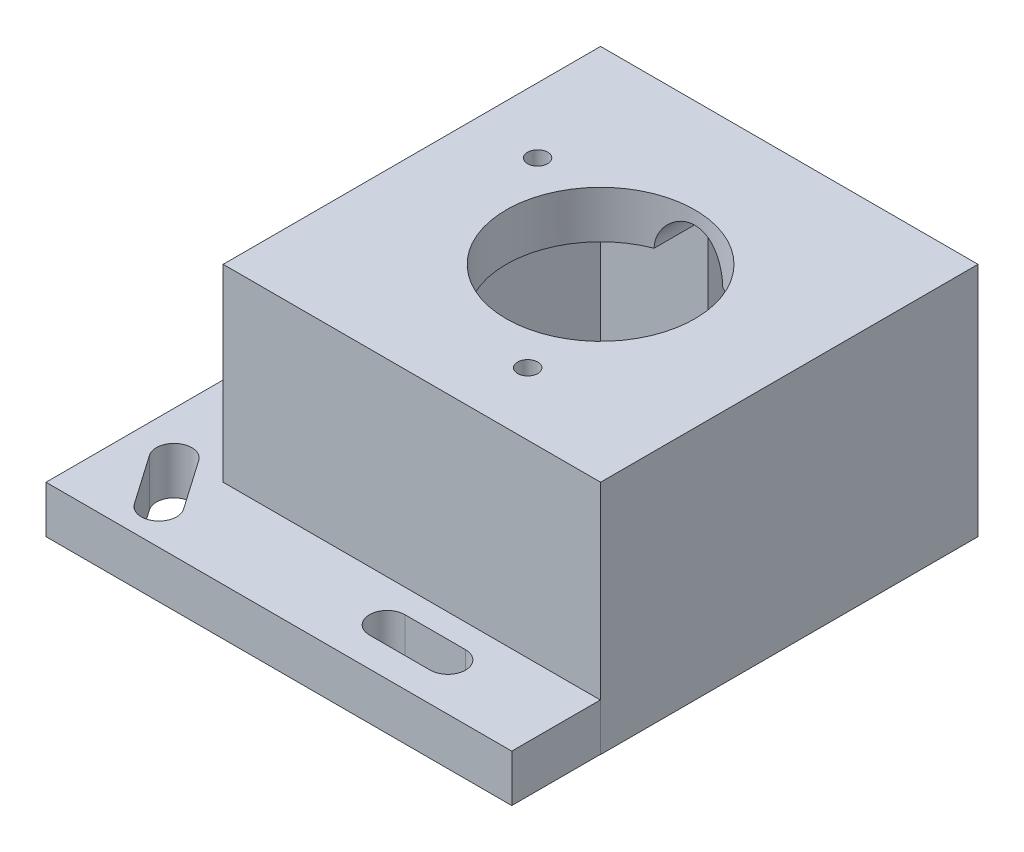
from build123d import *

# Parameters (mm, degrees)
SKETCH1_W             = 50.8
SKETCH1_H             = 50.8
SKETCH1_R             = 12.7
BOSS_EXTRUDE2_DEPTH   = 31.75
BOSS_EXTRUDE5_DEPTH   = 6.35
CUT_EXTRUDE2_DEPTH    = 6.35
CUT_EXTRUDE3_DEPTH    = 6.35
SKETCH12_W            = 38.1
SKETCH12_H            = 38.1
CUT_EXTRUDE6_DEPTH    = 25.4
F_6_32_TAPPED_HOLE3_D = 2.7051
CUT_EXTRUDE7_DEPTH    = 25.4


with BuildPart() as part:
    # Sketch1 → Boss-Extrude2 (new body)
    with BuildSketch(Plane(origin=(0, 0, 0), x_dir=(1, 0, 0), z_dir=(0, 1, 0))):
        Rectangle(SKETCH1_W, SKETCH1_H)
        with Locations(Location((0, 0, 0), (0, 0, 270))):
            Circle(SKETCH1_R, mode=Mode.SUBTRACT)
    extrude(amount=BOSS_EXTRUDE2_DEPTH)

    # Sketch4 → Boss-Extrude5 (add)
    with BuildSketch(Plane(origin=(0, 0, 0), x_dir=(-1, 0, 0), z_dir=(0, -1, 0))):
        Polygon((25.4, -25.4), (-25.366380646, -25.4), (-25.366380646, -37.321328202), (37.321328153, -37.321328202), (37.321328153, -25.4), (37.321328153, 25.4), (25.4, 25.4), align=None)
    extrude(amount=-BOSS_EXTRUDE5_DEPTH)

    # Sketch11 → Cut-Extrude2 (cut)
    with BuildSketch(Plane(origin=(0, 6.35, 0), x_dir=(1, 0, 0), z_dir=(0, 1, 0))):
        with BuildLine():
            Line((-28.60675, 10.43410283), (-28.60675, 2.26589717))
            ThreePointArc((-28.60675, 2.26589717), (-30.988, -0.11535283), (-33.36925, 2.26589717))
            Line((-33.36925, 2.26589717), (-33.36925, 10.43410283))
            ThreePointArc((-33.36925, 10.43410283), (-30.988, 12.81535283), (-28.60675, 10.43410283))
        make_face()
        with BuildLine():
            Line((-29.587864683, -24.49752021), (-24.922781552, -31.202487256))
            ThreePointArc((-24.922781552, -31.202487256), (-25.517462167, -34.517160405), (-28.832135317, -33.92247979))
            Line((-28.832135317, -33.92247979), (-33.497218448, -27.217512744))
            ThreePointArc((-33.497218448, -27.217512744), (-32.902537833, -23.902839595), (-29.587864683, -24.49752021))
        make_face()
    extrude(amount=-CUT_EXTRUDE2_DEPTH, mode=Mode.SUBTRACT)

    # Sketch10 → Cut-Extrude3 (cut)
    with BuildSketch(Plane(origin=(0, 6.35, 0), x_dir=(1, 0, 0), z_dir=(0, 1, 0))):
        with BuildLine():
            Line((10.434102814, -33.36925), (2.265897186, -33.36925))
            ThreePointArc((2.265897186, -33.36925), (-0.115352814, -30.988), (2.265897186, -28.60675))
            Line((2.265897186, -28.60675), (10.434102814, -28.60675))
            ThreePointArc((10.434102814, -28.60675), (12.815352814, -30.988), (10.434102814, -33.36925))
        make_face()
    extrude(amount=-CUT_EXTRUDE3_DEPTH, mode=Mode.SUBTRACT)

    # Sketch12 → Cut-Extrude6 (cut)
    with BuildSketch(Plane(origin=(0, 0, 0), x_dir=(-1, 0, 0), z_dir=(0, -1, 0))):
        Rectangle(SKETCH12_W, SKETCH12_H)
    extrude(amount=-CUT_EXTRUDE6_DEPTH, mode=Mode.SUBTRACT)

    # #6-32 Tapped Hole3 (through all)
    with Locations(Plane(origin=(7.158073922, 31.75, 16.96706293), x_dir=(0, 0, 1), z_dir=(0, 1, 0))):
        with Locations((0, 0), (-25.125718539, -23.79160959)):
            Hole(F_6_32_TAPPED_HOLE3_D / 2)

    # Sketch18 → Cut-Extrude7 (cut)
    with BuildSketch(Plane(origin=(0, 0, -25.4), x_dir=(-1, 0, 0), z_dir=(0, 0, -1))):
        with BuildLine():
            Line((4.620408953, 25.334287556), (4.620408953, 9.209712444))
            ThreePointArc((4.620408953, 9.209712444), (0, 4.589303492), (-4.620408953, 9.209712444))
            Line((-4.620408953, 9.209712444), (-4.620408953, 25.334287556))
            ThreePointArc((-4.620408953, 25.334287556), (0, 29.954696508), (4.620408953, 25.334287556))
        make_face()
    extrude(amount=-CUT_EXTRUDE7_DEPTH, mode=Mode.SUBTRACT)


solid = part.part
